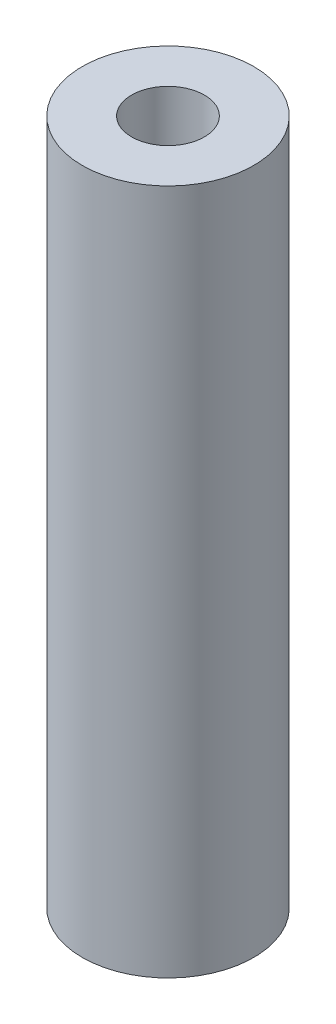
from build123d import *

# Parameters (mm, degrees)
SKETCH1_R           = 4.7625
SKETCH1_R_2         = 2.0193
BOSS_EXTRUDE1_DEPTH = 38.1


with BuildPart() as part:
    # Sketch1 → Boss-Extrude1 (new body)
    with BuildSketch(Plane(origin=(0, 0, 0), x_dir=(1, 0, 0), z_dir=(0, 1, 0))):
        with Locations(Location((0, 0, 0), (0, 0, 270))):
            Circle(SKETCH1_R)
        with Locations(Location((0, 0, 0), (0, 0, 270))):
            Circle(SKETCH1_R_2, mode=Mode.SUBTRACT)
    extrude(amount=BOSS_EXTRUDE1_DEPTH)


solid = part.part
